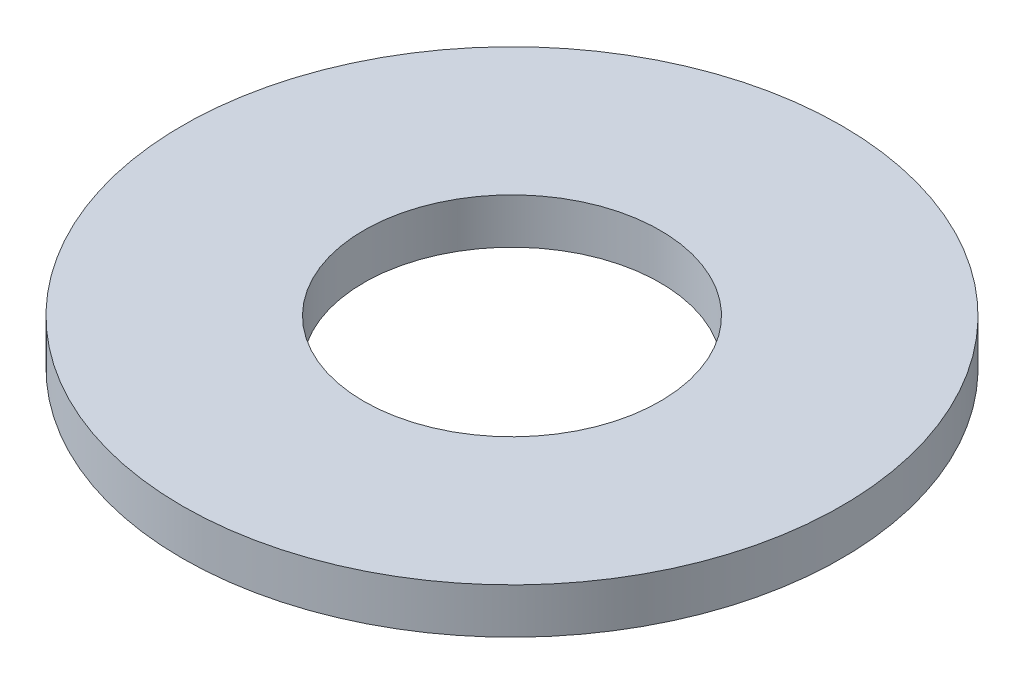
from build123d import *

# Parameters (mm, degrees)
SKETCH1_R           = 7.9375
BOSS_EXTRUDE1_DEPTH = 1.0922
SKETCH5_R           = 3.5687
CUT_EXTRUDE1_DEPTH  = 12.278329368


with BuildPart() as part:
    # Sketch1 → Boss-Extrude1 (new body)
    with BuildSketch(Plane(origin=(0, 0, 0), x_dir=(1, 0, 0), z_dir=(0, 1, 0))):
        with Locations(Location((0, 0, 0), (0, 0, 270))):
            Circle(SKETCH1_R)
    extrude(amount=BOSS_EXTRUDE1_DEPTH)

    # Sketch5 → Cut-Extrude1 (cut, through all)
    with BuildSketch(Plane(origin=(0, 1.0922, 0), x_dir=(-1, 0, 0), z_dir=(0, 1, 0))):
        with Locations(Location((0, 0, 0), (0, 0, 90))):
            Circle(SKETCH5_R)
    extrude(amount=-CUT_EXTRUDE1_DEPTH, mode=Mode.SUBTRACT)


solid = part.part
